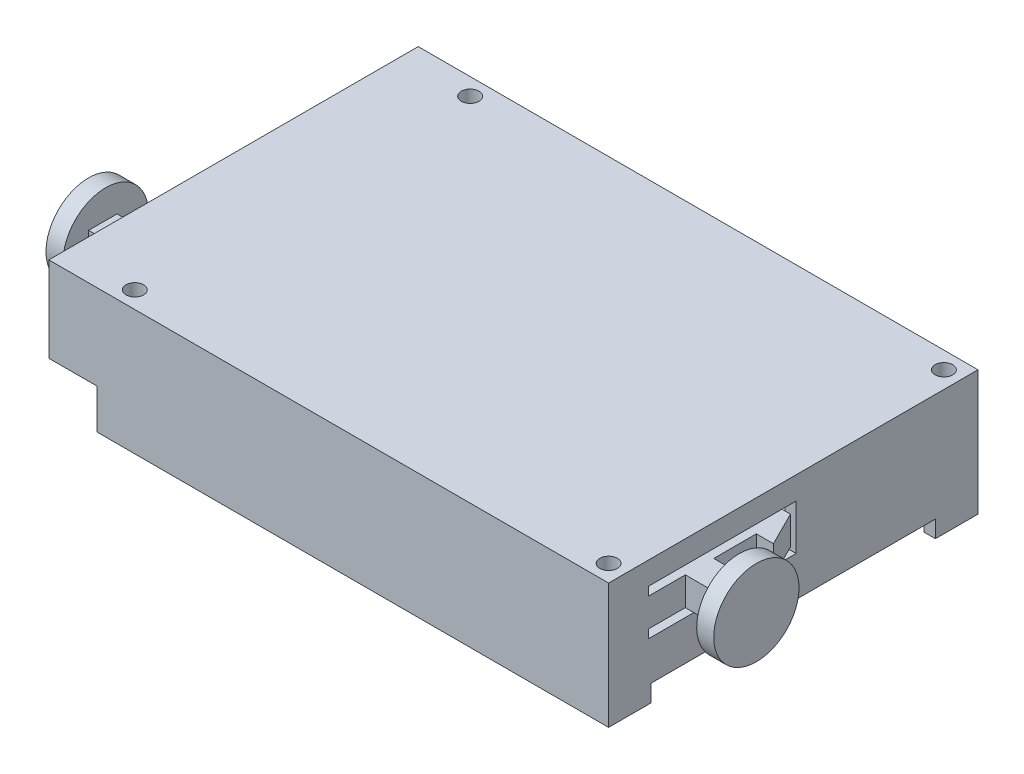
from build123d import *

# Parameters (mm, degrees)
SKETCH_1_W          = 98.5
SKETCH_1_H          = 65
EXTRUDE_1_DEPTH     = 2
SKETCH_2_W          = 98.5
SKETCH_2_H          = 65
SKETCH_2_W_2        = 94.5
SKETCH_2_H_2        = 62
EXTRUDE_2_DEPTH     = 20
SKETCH_3_W          = 20
SKETCH_3_H          = 6
SKETCH_3_W_2        = 15.9
SKETCH_3_H_2        = 7
CUT_EXTRUDE_1_DEPTH = 8.5
CUT_EXTRUDE_5_DEPTH = 106.633801408
SKETCH_8_W          = 6.5
SKETCH_8_H          = 5
EXTRUDE_5_DEPTH     = 5
SKETCH_9_R          = 1.55
CUT_EXTRUDE_7_DEPTH = 69.178534012
SKETCH_10_R         = 2.25
SKETCH_10_R_2       = 1.55
EXTRUDE_6_DEPTH     = 20
SKETCH_11_W         = 50
SKETCH_11_H         = 6
CUT_EXTRUDE_8_DEPTH = 10
EXTRUDE_8_DEPTH     = 20
SKETCH_16_R         = 1.75
CUT_EXTRUDE_9_DEPTH = 15
SKETCH_17_R         = 7.5
EXTRUDE_9_DEPTH     = 3
EXTRUDE_START       = 3
SKETCH_18_R         = 7.5
EXTRUDE_10_DEPTH    = 3


with BuildPart() as part:
    # 草图1 → 凸台-拉伸1 (new body)
    with BuildSketch(Plane(origin=(0, 0, 0), x_dir=(1, 0, 0), z_dir=(0, 1, 0))):
        Rectangle(SKETCH_1_W, SKETCH_1_H)
    extrude(amount=EXTRUDE_1_DEPTH)

    # 草图2 → 凸台-拉伸2 (add)
    with BuildSketch(Plane(origin=(0, 0, 0), x_dir=(-1, 0, 0), z_dir=(0, -1, 0))):
        Rectangle(SKETCH_2_W, SKETCH_2_H)
        Rectangle(SKETCH_2_W_2, SKETCH_2_H_2, mode=Mode.SUBTRACT)
    extrude(amount=EXTRUDE_2_DEPTH)

    # 草图3 → 切除-拉伸1 (cut)
    with BuildSketch(Plane.ZY.offset(49.25)):
        with Locations((-10.4, -17)):
            Rectangle(SKETCH_3_W, SKETCH_3_H)
        with Locations((24.55, -16.5)):
            Rectangle(SKETCH_3_W_2, SKETCH_3_H_2)
    extrude(amount=-CUT_EXTRUDE_1_DEPTH, mode=Mode.SUBTRACT)

    # 草图7 → 切除-拉伸5 (cut, through all)
    with BuildSketch(Plane.ZY.offset(49.25)):
        Polygon((25.5, -3.5), (25.5, -2), (-0.5, -2), (-0.5, -10), (25.5, -10), (25.5, -8.5), (0.5, -8.5), (0.5, -3.5), align=None)
    extrude(amount=-CUT_EXTRUDE_5_DEPTH, mode=Mode.SUBTRACT)

    # 草图8 → 凸台-拉伸5 (add)
    with BuildSketch(Plane(origin=(0, -3.5, 0), x_dir=(1, 0, 0), z_dir=(0, 1, 0))):
        Polygon((-49.25, -0.5), (-52.25, -6.5), (-49.25, -6.5), align=None)
        Polygon((49.25, -0.5), (52.25, -6.5), (49.25, -6.5), align=None)
        with Locations((52.5, -16.5)):
            Rectangle(SKETCH_8_W, SKETCH_8_H)
        with Locations((-52.5, -16.5)):
            Rectangle(SKETCH_8_W, SKETCH_8_H)
    extrude(amount=-EXTRUDE_5_DEPTH)

    # 草图9 → 切除-拉伸7 (cut, through all)
    with BuildSketch(Plane(origin=(0, 2, 0), x_dir=(1, 0, 0), z_dir=(0, 1, 0))):
        with Locations(Location((46.25, 29.5, 0), (0, 0, 270))):
            Circle(SKETCH_9_R)
        with Locations(Location((46.25, -29.5, 0), (0, 0, 270))):
            Circle(SKETCH_9_R)
        with Locations(Location((-37.117, 29.5, 0), (0, 0, 270))):
            Circle(SKETCH_9_R)
        with Locations(Location((-37.117, -29.5, 0), (0, 0, 270))):
            Circle(SKETCH_9_R)
    extrude(amount=-CUT_EXTRUDE_7_DEPTH, mode=Mode.SUBTRACT)

    # 草图10 → 凸台-拉伸6 (add, through all)
    # profile 1 of 4: a face of its own
    with BuildSketch(Plane(origin=(0, 0, 0), x_dir=(-1, 0, 0), z_dir=(0, -1, 0))):
        with Locations((-46.25, 29.5)):
            Circle(SKETCH_10_R)
        with Locations(Location((-46.25, 29.5, 0), (0, 0, 270))):
            Circle(SKETCH_10_R_2, mode=Mode.SUBTRACT)
    # profile 2 of 4: a face of its own
    with BuildSketch(Plane(origin=(0, 0, 0), x_dir=(-1, 0, 0), z_dir=(0, -1, 0))):
        with Locations((37.117, 29.5)):
            Circle(SKETCH_10_R)
        with Locations(Location((37.117, 29.5, 0), (0, 0, 270))):
            Circle(SKETCH_10_R_2, mode=Mode.SUBTRACT)
    # profile 3 of 4: a face of its own
    with BuildSketch(Plane(origin=(0, 0, 0), x_dir=(-1, 0, 0), z_dir=(0, -1, 0))):
        with Locations((-46.25, -29.5)):
            Circle(SKETCH_10_R)
        with Locations(Location((-46.25, -29.5, 0), (0, 0, 270))):
            Circle(SKETCH_10_R_2, mode=Mode.SUBTRACT)
    # profile 4 of 4: a face of its own
    with BuildSketch(Plane(origin=(0, 0, 0), x_dir=(-1, 0, 0), z_dir=(0, -1, 0))):
        with Locations((37.117, -29.5)):
            Circle(SKETCH_10_R)
        with Locations(Location((37.117, -29.5, 0), (0, 0, 270))):
            Circle(SKETCH_10_R_2, mode=Mode.SUBTRACT)
    extrude(amount=EXTRUDE_6_DEPTH)

    # 草图11 → 切除-拉伸8 (cut)
    with BuildSketch(Plane(origin=(49.25, 0, 0), x_dir=(0, 0, -1), z_dir=(1, 0, 0))):
        with Locations((0, -20)):
            Rectangle(SKETCH_11_W, SKETCH_11_H)
    extrude(amount=-CUT_EXTRUDE_8_DEPTH, mode=Mode.SUBTRACT)

    # 草图15 → 凸台-拉伸8 (add, through all)
    with BuildSketch(Plane(origin=(0, 0, 0), x_dir=(-1, 0, 0), z_dir=(0, -1, 0))):
        with BuildLine():
            Line((-43.95, 26), (-43.95, 31))
            Line((-43.95, 31), (-44.572949017, 31))
            ThreePointArc((-44.572949017, 31), (-44.459916807, 28.136877788), (-47.25, 27.484435563))
            Line((-47.25, 27.484435563), (-47.25, 26))
            Line((-47.25, 26), (-43.95, 26))
        make_face()
        with BuildLine():
            Line((-44.572949017, -31), (-43.95, -31))
            Line((-43.95, -31), (-43.95, -26))
            Line((-43.95, -26), (-47.25, -26))
            Line((-47.25, -26), (-47.25, -27.484435563))
            ThreePointArc((-47.25, -27.484435563), (-44.459916807, -28.136877788), (-44.572949017, -31))
        make_face()
        with BuildLine():
            Line((35.439949017, 31), (34.817, 31))
            Line((34.817, 31), (34.817, 26))
            Line((34.817, 26), (41.817, 26))
            Line((41.817, 26), (41.817, 31))
            Line((41.817, 31), (38.794050983, 31))
            ThreePointArc((38.794050983, 31), (37.117, 27.25), (35.439949017, 31))
        make_face()
        with BuildLine():
            Line((34.817, -26), (34.817, -31))
            Line((34.817, -31), (35.439949017, -31))
            ThreePointArc((35.439949017, -31), (37.117, -27.25), (38.794050983, -31))
            Line((38.794050983, -31), (40.75, -31))
            Line((40.75, -31), (40.75, -26))
            Line((40.75, -26), (34.817, -26))
        make_face()
    extrude(amount=EXTRUDE_8_DEPTH)

    # 草图16 → 切除-拉伸9 (cut)
    with BuildSketch(Plane(origin=(0, -20, 0), x_dir=(-1, 0, 0), z_dir=(0, -1, 0))):
        with Locations(Location((-46.25, 29.5, 0), (0, 0, 90))):
            Circle(SKETCH_16_R)
        with Locations(Location((37.117, 29.5, 0), (0, 0, 90))):
            Circle(SKETCH_16_R)
        with Locations(Location((37.117, -29.5, 0), (0, 0, 90))):
            Circle(SKETCH_16_R)
        with Locations(Location((-46.25, -29.5, 0), (0, 0, 90))):
            Circle(SKETCH_16_R)
    extrude(amount=-CUT_EXTRUDE_9_DEPTH, mode=Mode.SUBTRACT)

    # 草图17 → 凸台-拉伸9 (add)
    with BuildSketch(Plane(origin=(55.75, 0, 0), x_dir=(0, 0, -1), z_dir=(1, 0, 0))):
        with Locations(Location((-16, -6, 0), (0, 0, 90))):
            Circle(SKETCH_17_R)
    extrude(amount=EXTRUDE_9_DEPTH)

    # 草图18 → 凸台-拉伸10 (add)
    with BuildSketch(Plane.ZY.offset(55.75).offset(EXTRUDE_START)):
        with Locations(Location((16, -6, 0), (0, 0, 90))):
            Circle(SKETCH_18_R)
    extrude(amount=-EXTRUDE_10_DEPTH)


solid = part.part
